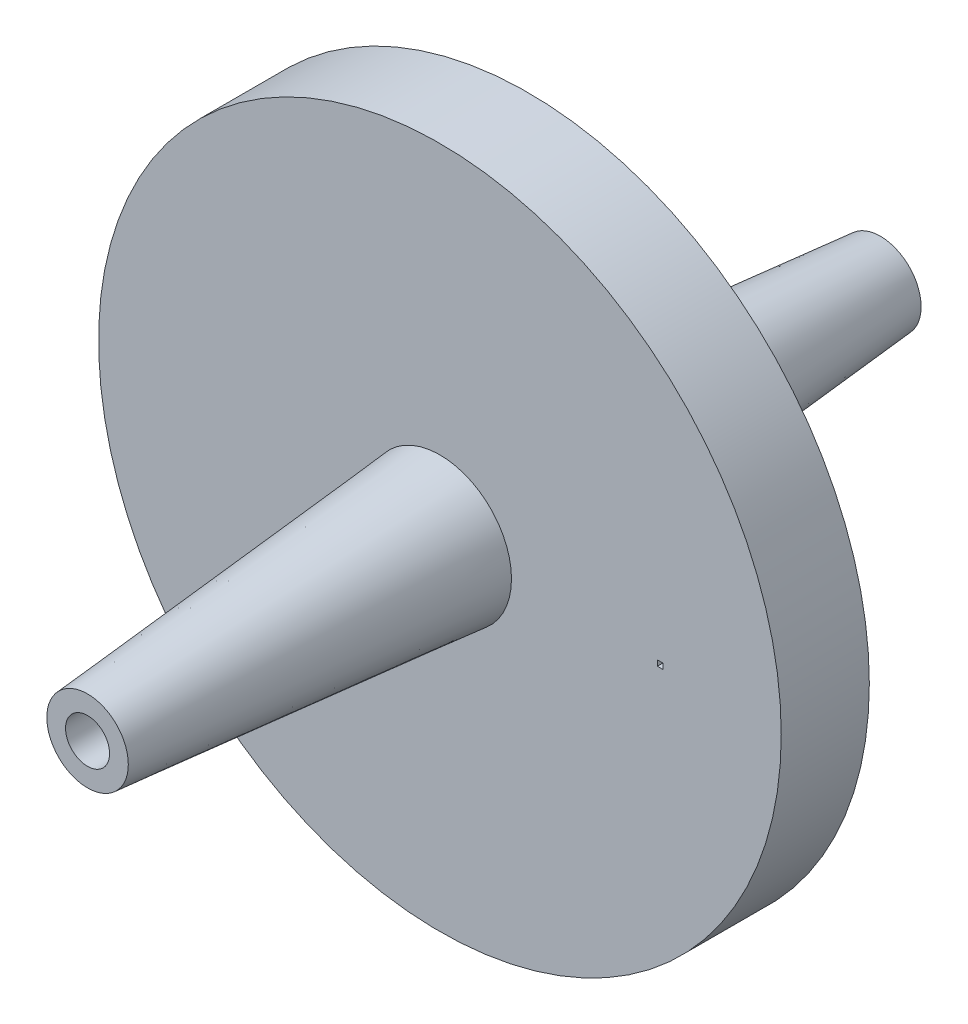
from build123d import *

# Parameters (mm, degrees)
SKETCH1_R           = 31
BOSS_EXTRUDE1_DEPTH = 4
SKETCH3_R           = 6.5
BOSS_EXTRUDE2_DEPTH = 32
BOSS_EXTRUDE2_TAPER = 5
SKETCH4_R           = 2
CUT_EXTRUDE1_DEPTH  = 85.297093663
SKETCH5_W           = 0.5
SKETCH5_H           = 0.5
CUT_EXTRUDE2_DEPTH  = 0.5


with BuildPart() as part:
    # Sketch1 → Boss-Extrude1 (new, symmetric)
    with BuildSketch(Plane.XY):
        Circle(SKETCH1_R)
    extrude(amount=BOSS_EXTRUDE1_DEPTH, both=True)

    # Sketch3 → Boss-Extrude2 (add)
    with BuildSketch(Plane.XY.offset(4)):
        Circle(SKETCH3_R)
    boss_extrude2 = extrude(amount=BOSS_EXTRUDE2_DEPTH, taper=BOSS_EXTRUDE2_TAPER)

    # Mirror1: Boss-Extrude2 across plane
    add(boss_extrude2.mirror(Plane.XY))

    # Sketch4 → Cut-Extrude1 (cut, through all)
    with BuildSketch(Plane.XY.offset(36)):
        Circle(SKETCH4_R)
    extrude(amount=-CUT_EXTRUDE1_DEPTH, mode=Mode.SUBTRACT)

    # Sketch5 → Cut-Extrude2 (cut)
    with BuildSketch(Plane.XY.offset(4)):
        with Locations((20, 0)):
            Rectangle(SKETCH5_W, SKETCH5_H)
    extrude(amount=-CUT_EXTRUDE2_DEPTH, mode=Mode.SUBTRACT)


solid = part.part
